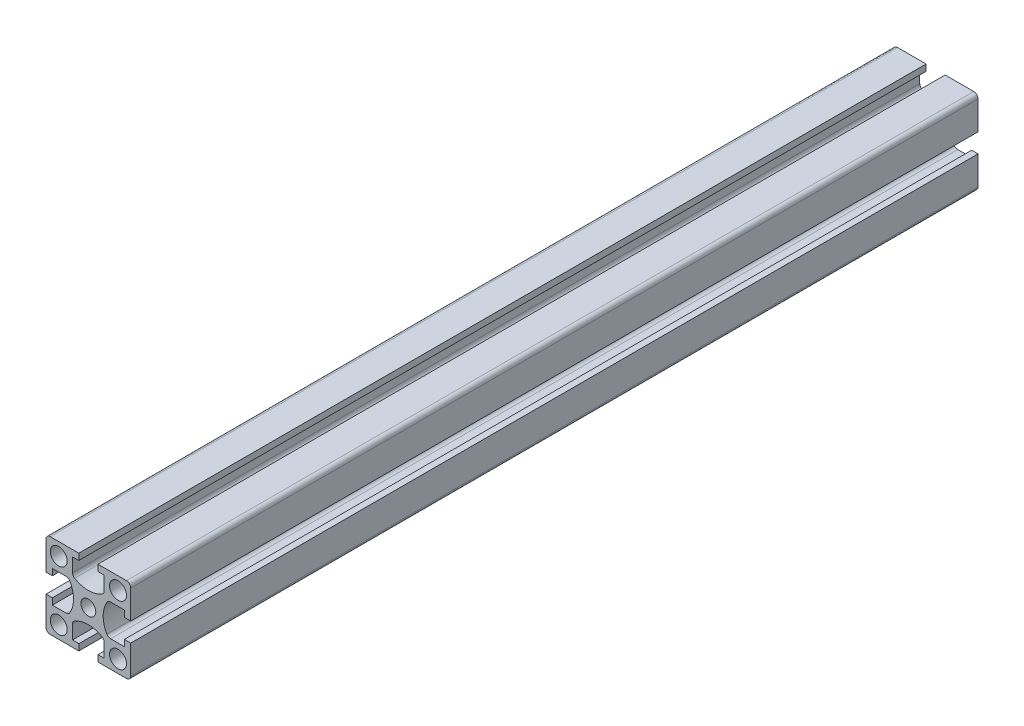
from build123d import *

# Parameters (mm, degrees)
SKETCH1_R           = 2
SKETCH1_R_2         = 1.75
BOSS_EXTRUDE1_DEPTH = 200


with BuildPart() as part:
    # Sketch1 → Boss-Extrude1 (new body)
    with BuildSketch(Plane.XY):
        with BuildLine():
            Line((-10, 9), (-10, 2.25))
            Line((-10, 2.25), (-8.5, 2.25))
            Line((-8.5, 2.25), (-8.5, 3.75))
            Line((-8.5, 3.75), (-5.236860279, 3.75))
            ThreePointArc((-5.236860279, 3.75), (-4.736860279, 3.616025404), (-4.370834875, 3.25))
            ThreePointArc((-4.370834875, 3.25), (-3.5, 0), (-4.370834875, -3.25))
            ThreePointArc((-4.370834875, -3.25), (-4.736860279, -3.616025404), (-5.236860279, -3.75))
            Line((-5.236860279, -3.75), (-8.5, -3.75))
            Line((-8.5, -3.75), (-8.5, -2.25))
            Line((-8.5, -2.25), (-10, -2.25))
            Line((-10, -2.25), (-10, -9))
            ThreePointArc((-10, -9), (-9.707106781, -9.707106781), (-9, -10))
            Line((-9, -10), (-2.25, -10))
            Line((-2.25, -10), (-2.25, -8.5))
            Line((-2.25, -8.5), (-3.75, -8.5))
            Line((-3.75, -8.5), (-3.75, -5.236860279))
            ThreePointArc((-3.75, -5.236860279), (-3.616025404, -4.736860279), (-3.25, -4.370834875))
            ThreePointArc((-3.25, -4.370834875), (0, -3.5), (3.25, -4.370834875))
            ThreePointArc((3.25, -4.370834875), (3.616025404, -4.736860279), (3.75, -5.236860279))
            Line((3.75, -5.236860279), (3.75, -8.5))
            Line((3.75, -8.5), (2.25, -8.5))
            Line((2.25, -8.5), (2.25, -10))
            Line((2.25, -10), (9, -10))
            ThreePointArc((9, -10), (9.707106781, -9.707106781), (10, -9))
            Line((10, -9), (10, -2.25))
            Line((10, -2.25), (8.5, -2.25))
            Line((8.5, -2.25), (8.5, -3.75))
            Line((8.5, -3.75), (5.236860279, -3.75))
            ThreePointArc((5.236860279, -3.75), (4.736860279, -3.616025404), (4.370834875, -3.25))
            ThreePointArc((4.370834875, -3.25), (3.5, 0), (4.370834875, 3.25))
            ThreePointArc((4.370834875, 3.25), (4.736860279, 3.616025404), (5.236860279, 3.75))
            Line((5.236860279, 3.75), (8.5, 3.75))
            Line((8.5, 3.75), (8.5, 2.25))
            Line((8.5, 2.25), (10, 2.25))
            Line((10, 2.25), (10, 9))
            ThreePointArc((10, 9), (9.707106781, 9.707106781), (9, 10))
            Line((9, 10), (2.25, 10))
            Line((2.25, 10), (2.25, 8.5))
            Line((2.25, 8.5), (3.75, 8.5))
            Line((3.75, 8.5), (3.75, 5.236860279))
            ThreePointArc((3.75, 5.236860279), (3.616025404, 4.736860279), (3.25, 4.370834875))
            ThreePointArc((3.25, 4.370834875), (0, 3.5), (-3.25, 4.370834875))
            ThreePointArc((-3.25, 4.370834875), (-3.616025404, 4.736860279), (-3.75, 5.236860279))
            Line((-3.75, 5.236860279), (-3.75, 8.5))
            Line((-3.75, 8.5), (-2.25, 8.5))
            Line((-2.25, 8.5), (-2.25, 10))
            Line((-2.25, 10), (-9, 10))
            ThreePointArc((-9, 10), (-9.707106781, 9.707106781), (-10, 9))
        make_face()
        with Locations((-7, -7)):
            Circle(SKETCH1_R, mode=Mode.SUBTRACT)
        with Locations((7, -7)):
            Circle(SKETCH1_R, mode=Mode.SUBTRACT)
        with Locations((7, 7)):
            Circle(SKETCH1_R, mode=Mode.SUBTRACT)
        Circle(SKETCH1_R_2, mode=Mode.SUBTRACT)
        with Locations((-7, 7)):
            Circle(SKETCH1_R, mode=Mode.SUBTRACT)
    extrude(amount=BOSS_EXTRUDE1_DEPTH)


solid = part.part
